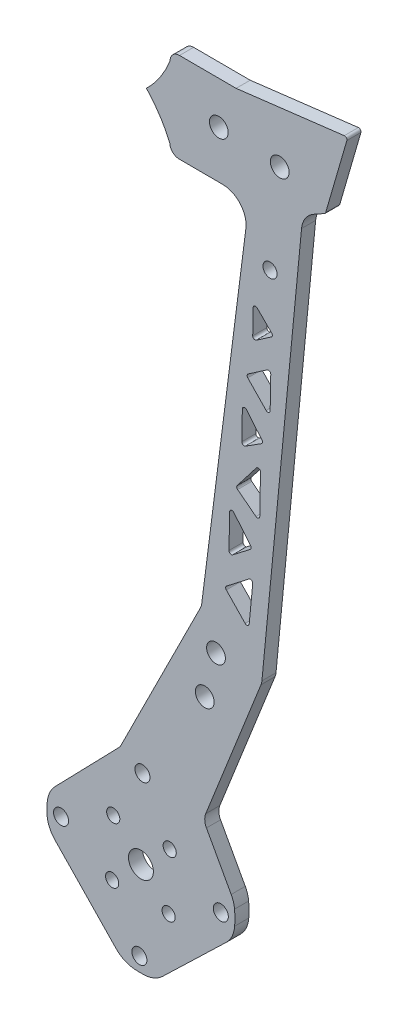
from build123d import *

# Parameters (mm, degrees)
SKETCH_1_R          = 1.6
SKETCH_1_R_2        = 2
SKETCH_1_R_3        = 1.5
SKETCH_1_R_4        = 1.4
SKETCH_1_R_5        = 2.65
EXTRUDE_1_DEPTH     = 3
EXTRUDE_START       = -3
SKETCH_2_R          = 2
EXTRUDE_2_DEPTH     = 3
SKETCH_3_R          = 2
CUT_EXTRUDE_1_DEPTH = 292.701502722


with BuildPart() as part:
    # 草图1 → 凸台-拉伸1 (new body)
    with BuildSketch(Plane.XY):
        with BuildLine():
            Line((180.876359785, 205.228138488), (168.831228405, 205.268129507))
            ThreePointArc((168.831228405, 205.268129507), (167.414263571, 204.689029851), (166.821803423, 203.277599114))
            add(Edge.make_bspline(
                [(161.786060078, 195.71078825), (165.139642387, 198.941974737), (166.821803423, 203.277599114)],
                knots=[0, 0, 0, 1, 1, 1], degree=2))
            add(Edge.make_bspline(
                [(161.786060078, 195.71078825), (164.92793776, 192.361073548), (166.750316725, 188.143977385)],
                knots=[0, 0, 0, 1, 1, 1], degree=2))
            ThreePointArc((166.750316725, 188.143977385), (167.329416381, 186.727012552), (168.740847117, 186.134552403))
            Line((168.740847117, 186.134552403), (178.027494719, 186.090685063))
            ThreePointArc((178.027494719, 186.090685063), (181.763769971, 184.38667788), (182.963862725, 180.459443405))
            Line((182.963862725, 180.459443405), (173.564244058, 106.60839258))
            ThreePointArc((173.564244058, 106.60839258), (173.458389771, 106.114066832), (173.271035356, 105.644533662))
            Line((173.271035356, 105.644533662), (156.40182897, 71.937427408))
            ThreePointArc((156.40182897, 71.937427408), (156.165380125, 71.54355997), (155.871567565, 71.190411567))
            Line((155.871567565, 71.190411567), (142.35670304, 57.268944585))
            ThreePointArc((142.35670304, 57.268944585), (141.191974376, 55.555727126), (140.679319548, 53.548517136))
            ThreePointArc((140.679319548, 53.548517136), (140.625900814, 52.473146463), (140.63043091, 51.396459358))
            ThreePointArc((140.63043091, 51.396459358), (141.098279223, 49.25350905), (142.305067834, 47.421903384))
            Line((142.305067834, 47.421903384), (155.331422881, 33.891052634))
            ThreePointArc((155.331422881, 33.891052634), (157.115873944, 32.615571364), (159.239509549, 32.066672572))
            ThreePointArc((159.239509549, 32.066672572), (160.240879339, 32.022528199), (161.243203239, 32.028609273))
            ThreePointArc((161.243203239, 32.028609273), (163.386153547, 32.496457586), (165.217759213, 33.703246197))
            Line((165.217759213, 33.703246197), (178.748609963, 46.729601244))
            ThreePointArc((178.748609963, 46.729601244), (180.024091234, 48.514052307), (180.572990025, 50.637687912))
            ThreePointArc((180.572990025, 50.637687912), (180.619914226, 52.200895683), (180.544552467, 53.762990758))
            ThreePointArc((180.544552467, 53.762990758), (180.310185029, 54.977736199), (179.831664348, 56.118592254))
            Line((179.831664348, 56.118592254), (174.566586824, 65.746386199))
            ThreePointArc((174.566586824, 65.746386199), (174.20435551, 67.001908028), (174.410236103, 68.292318726))
            Line((174.410236103, 68.292318726), (186.173266888, 97.935631449))
            ThreePointArc((186.173266888, 97.935631449), (186.3010118, 98.338133742), (186.37097439, 98.754585534))
            Line((186.37097439, 98.754585534), (194.807070925, 186.357605284))
            ThreePointArc((194.807070925, 186.357605284), (195.598752445, 188.613890348), (197.347624572, 190.244543041))
            Line((197.347624572, 190.244543041), (199.704104393, 191.559498626))
            ThreePointArc((199.704104393, 191.559498626), (199.85169861, 191.684777969), (199.940640273, 191.856732461))
            Line((199.940640273, 191.856732461), (204.447932197, 207.383938176))
            ThreePointArc((204.447932197, 207.383938176), (204.348738584, 207.847132715), (203.907590711, 208.019693161))
            Line((203.907590711, 208.019693161), (180.876359785, 205.228138488))
        make_face()
        with Locations((160.943625523, 69.015853918)):
            Circle(SKETCH_1_R, mode=Mode.SUBTRACT)
        with Locations((177.617675606, 51.696037122)):
            Circle(SKETCH_1_R, mode=Mode.SUBTRACT)
        with Locations((160.29785881, 35.02198704)):
            Circle(SKETCH_1_R, mode=Mode.SUBTRACT)
        with Locations((176.600254281, 99.006041366)):
            Circle(SKETCH_1_R_2, mode=Mode.SUBTRACT)
        with Locations((174.2076694, 89.744683982)):
            Circle(SKETCH_1_R_2, mode=Mode.SUBTRACT)
        with Locations((188.100780779, 175.340948835)):
            Circle(SKETCH_1_R_3, mode=Mode.SUBTRACT)
        with Locations((193.30497456, 194.25027454)):
            Circle(SKETCH_1_R_2, mode=Mode.SUBTRACT)
        with Locations((177.198714362, 196.226687268)):
            Circle(SKETCH_1_R_2, mode=Mode.SUBTRACT)
        with Locations((143.623808727, 52.341803836)):
            Circle(SKETCH_1_R, mode=Mode.SUBTRACT)
        with Locations((166.515909108, 45.895440526)):
            Circle(SKETCH_1_R_4, mode=Mode.SUBTRACT)
        with Locations((166.744222119, 57.91408742)):
            Circle(SKETCH_1_R_4, mode=Mode.SUBTRACT)
        with Locations((154.497262214, 46.123753537)):
            Circle(SKETCH_1_R_4, mode=Mode.SUBTRACT)
        with Locations((154.725575225, 58.142400432)):
            Circle(SKETCH_1_R_4, mode=Mode.SUBTRACT)
        with Locations((160.620742166, 52.018920479)):
            Circle(SKETCH_1_R_5, mode=Mode.SUBTRACT)
        with BuildLine():
            Line((188.440185855, 163.909601849), (185.367574986, 166.984339314))
            ThreePointArc((185.367574986, 166.984339314), (184.827033477, 167.094676686), (184.513989502, 166.640404821))
            Line((184.513989502, 166.640404821), (184.414122911, 161.383318097))
            ThreePointArc((184.414122911, 161.383318097), (184.67712622, 160.933508785), (185.197409188, 160.961877628))
            Line((185.197409188, 160.961877628), (188.369886648, 163.144226888))
            ThreePointArc((188.369886648, 163.144226888), (188.584414353, 163.510438603), (188.440185855, 163.909601849))
        make_face(mode=Mode.SUBTRACT)
        with BuildLine():
            Line((187.472818663, 156.632762387), (183.440770681, 153.85911402))
            ThreePointArc((183.440770681, 153.85911402), (183.226691028, 153.497542793), (183.363942447, 153.100395594))
            Line((183.363942447, 153.100395594), (187.266298258, 149.046906048))
            ThreePointArc((187.266298258, 149.046906048), (187.809036476, 148.928189955), (188.126412768, 149.384184004))
            Line((188.126412768, 149.384184004), (188.25610494, 156.211321918))
            ThreePointArc((188.25610494, 156.211321918), (187.99310163, 156.66113123), (187.472818663, 156.632762387))
        make_face(mode=Mode.SUBTRACT)
        with BuildLine():
            Line((182.20568655, 146.790661355), (182.089798545, 140.690189901))
            ThreePointArc((182.089798545, 140.690189901), (182.344789249, 140.244786653), (182.857830944, 140.2586622))
            Line((182.857830944, 140.2586622), (186.260617668, 142.420502707))
            ThreePointArc((186.260617668, 142.420502707), (186.486525093, 142.765499158), (186.376380029, 143.162896669))
            Line((186.376380029, 143.162896669), (183.08948131, 147.101527616))
            ThreePointArc((183.08948131, 147.101527616), (182.539690059, 147.252837448), (182.20568655, 146.790661355))
        make_face(mode=Mode.SUBTRACT)
        with BuildLine():
            Line((185.171612374, 137.402888306), (181.107941286, 132.130958638))
            ThreePointArc((181.107941286, 132.130958638), (181.008086118, 131.761532658), (181.198701468, 131.429700776))
            Line((181.198701468, 131.429700776), (185.105024507, 128.418656815))
            ThreePointArc((185.105024507, 128.418656815), (185.626655398, 128.363912237), (185.910183153, 128.805169268))
            Line((185.910183153, 128.805169268), (186.067531203, 137.088142897))
            ThreePointArc((186.067531203, 137.088142897), (185.733347108, 137.569375609), (185.171612374, 137.402888306))
        make_face(mode=Mode.SUBTRACT)
        with BuildLine():
            Line((183.984397253, 122.483643411), (180.383752933, 126.798230005))
            ThreePointArc((180.383752933, 126.798230005), (179.833961683, 126.949539837), (179.499958174, 126.487363744))
            Line((179.499958174, 126.487363744), (179.363127608, 119.284452918))
            ThreePointArc((179.363127608, 119.284452918), (179.638411409, 118.828253811), (180.168779422, 118.879327956))
            Line((180.168779422, 118.879327956), (183.906254307, 121.767652188))
            ThreePointArc((183.906254307, 121.767652188), (184.097560783, 122.109032943), (183.984397253, 122.483643411))
        make_face(mode=Mode.SUBTRACT)
        with BuildLine():
            Line((183.611833626, 116.147486542), (178.84837762, 112.466283102))
            ThreePointArc((178.84837762, 112.466283102), (178.655459645, 112.107236418), (178.793914924, 111.723880183))
            Line((178.793914924, 111.723880183), (182.801955086, 107.560613253))
            ThreePointArc((182.801955086, 107.560613253), (183.326638992, 107.435215573), (183.659857408, 107.85945992))
            Line((183.659857408, 107.85945992), (184.415273253, 115.703930291))
            ThreePointArc((184.415273253, 115.703930291), (184.159230917, 116.189582633), (183.611833626, 116.147486542))
        make_face(mode=Mode.SUBTRACT)
    extrude(amount=EXTRUDE_1_DEPTH)

    # 草图2 → 凸台-拉伸2 (add)
    with BuildSketch(Plane.XY.offset(3).offset(EXTRUDE_START)):
        with Locations((193.30497456, 194.25027454)):
            Circle(SKETCH_2_R)
    extrude(amount=EXTRUDE_2_DEPTH)

    # 草图3 → 切除-拉伸1 (cut, through all)
    with BuildSketch(Plane.XY.offset(3)):
        with Locations((190.164017385, 195.374410179)):
            Circle(SKETCH_3_R)
    extrude(amount=-CUT_EXTRUDE_1_DEPTH, mode=Mode.SUBTRACT)


solid = part.part
